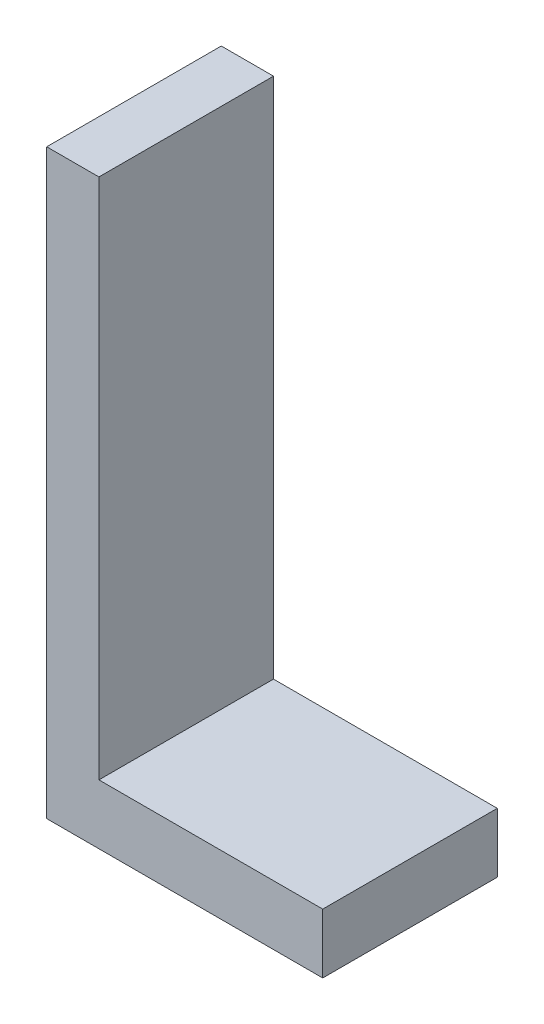
from build123d import *

# Parameters (mm, degrees)
BOSS_EXTRU_1_DEPTH = 1.5


with BuildPart() as part:
    # Esquisse1 → Boss.-Extru.1 (new body)
    with BuildSketch(Plane.XY):
        Polygon((-55.432465326, -17.870119076), (-54.983747377, -17.870119076), (-54.983747377, -22.357298563), (-53.060670454, -22.357298563), (-53.060670454, -22.870119076), (-55.432465326, -22.870119076), align=None)
    extrude(amount=BOSS_EXTRU_1_DEPTH)


solid = part.part
